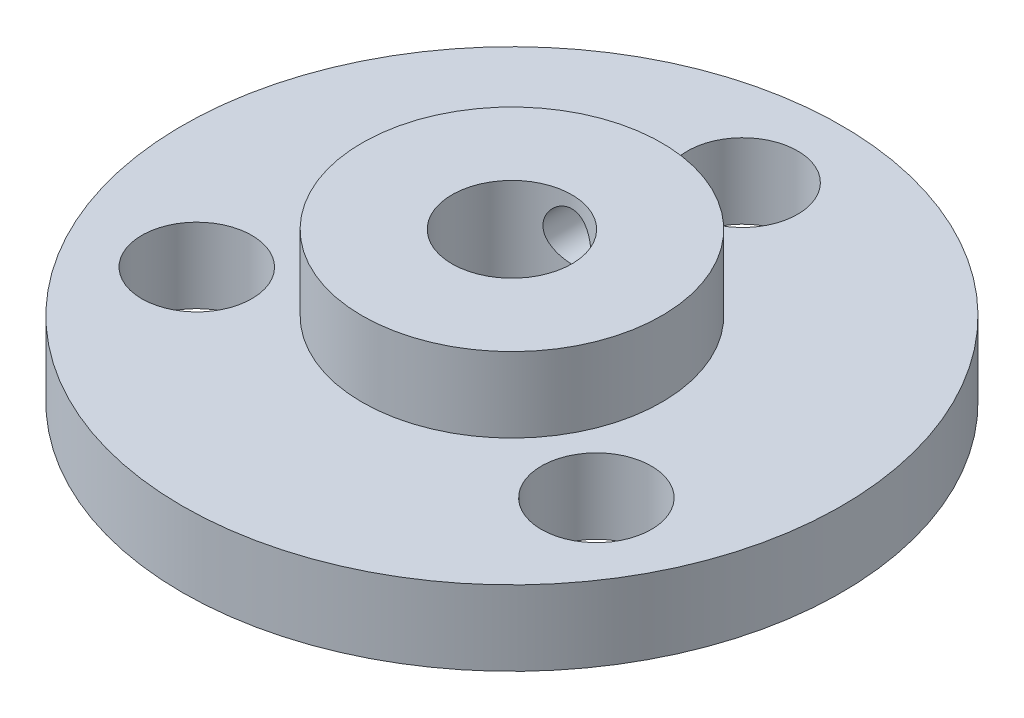
from build123d import *

# Parameters (mm, degrees)
ESBO_O1_R                                      = 11
RESSALTO_EXTRUS_O1_DEPTH                       = 2.5
ESBO_O3_R                                      = 1.835521505
CORTE_EXTRUS_O1_DEPTH                          = 2.5
ESBO_O18_R                                     = 5
RESSALTO_EXTRUS_O5_DEPTH                       = 2.5
ESBO_O20_R                                     = 2
CORTE_EXTRUS_O5_DEPTH                          = 5.5
BROCA_DE_ROSQUEAR_PARA_TARRAXA_DE_M2X0_4_REACH = 21.785
BROCA_DE_ROSQUEAR_PARA_TARRAXA_DE_M2_2_R       = 0.8


with BuildPart() as part:
    # Esboço1 → Ressalto-extrusão1 (new body)
    with BuildSketch(Plane(origin=(0, 0, 0), x_dir=(1, 0, 0), z_dir=(0, 1, 0))):
        with Locations(Location((0, 0, 0), (0, 0, 270))):
            Circle(ESBO_O1_R)
    extrude(amount=RESSALTO_EXTRUS_O1_DEPTH)

    # Esboço3 → Corte-extrusão1 (cut)
    with BuildSketch(Plane(origin=(0, 2.5, 0), x_dir=(1, 0, 0), z_dir=(0, 1, 0))):
        with Locations(Location((0, 7.7, 0), (0, 0, 270))):
            Circle(ESBO_O3_R)
        with Locations(Location((6.668395609, -3.85, 0), (0, 0, 270))):
            Circle(ESBO_O3_R)
        with Locations(Location((-6.668395609, -3.85, 0), (0, 0, 270))):
            Circle(ESBO_O3_R)
    extrude(amount=-CORTE_EXTRUS_O1_DEPTH, mode=Mode.SUBTRACT)

    # Esboço18 → Ressalto-extrusão5 (add)
    with BuildSketch(Plane(origin=(0, 2.5, 0), x_dir=(1, 0, 0), z_dir=(0, 1, 0))):
        with Locations(Location((0, 0, 0), (0, 0, 270))):
            Circle(ESBO_O18_R)
    extrude(amount=RESSALTO_EXTRUS_O5_DEPTH)

    # Esboço20 → Corte-extrusão5 (cut)
    with BuildSketch(Plane(origin=(0, 5, 0), x_dir=(1, 0, 0), z_dir=(0, 1, 0))):
        with Locations(Location((0, 0, 0), (0, 0, 270))):
            Circle(ESBO_O20_R)
    extrude(amount=-CORTE_EXTRUS_O5_DEPTH, mode=Mode.SUBTRACT)

    # Broca de rosquear para tarraxa de M2 2 (on position points) → Broca de rosquear para tarraxa de M2x0.41 (cut, up to next)
    with BuildSketch(Plane(origin=(0.002598781, 3.792959438, -4.999999325), x_dir=(-0.999999864927, 0, -0.000519756122), z_dir=(0.000519756122, 0, -0.999999864927)), mode=Mode.PRIVATE) as broca_de_rosquear_para_tarraxa_de_m2x0_4_sk1:
        Circle(BROCA_DE_ROSQUEAR_PARA_TARRAXA_DE_M2_2_R)
    broca_de_rosquear_para_tarraxa_de_m2x0_4_tool1 = extrude(broca_de_rosquear_para_tarraxa_de_m2x0_4_sk1.sketch, amount=-BROCA_DE_ROSQUEAR_PARA_TARRAXA_DE_M2X0_4_REACH, mode=Mode.PRIVATE) & part.part
    add(broca_de_rosquear_para_tarraxa_de_m2x0_4_tool1.solids().sort_by_distance((0.002599, 3.792959, -4.999999))[0], mode=Mode.SUBTRACT)


solid = part.part
